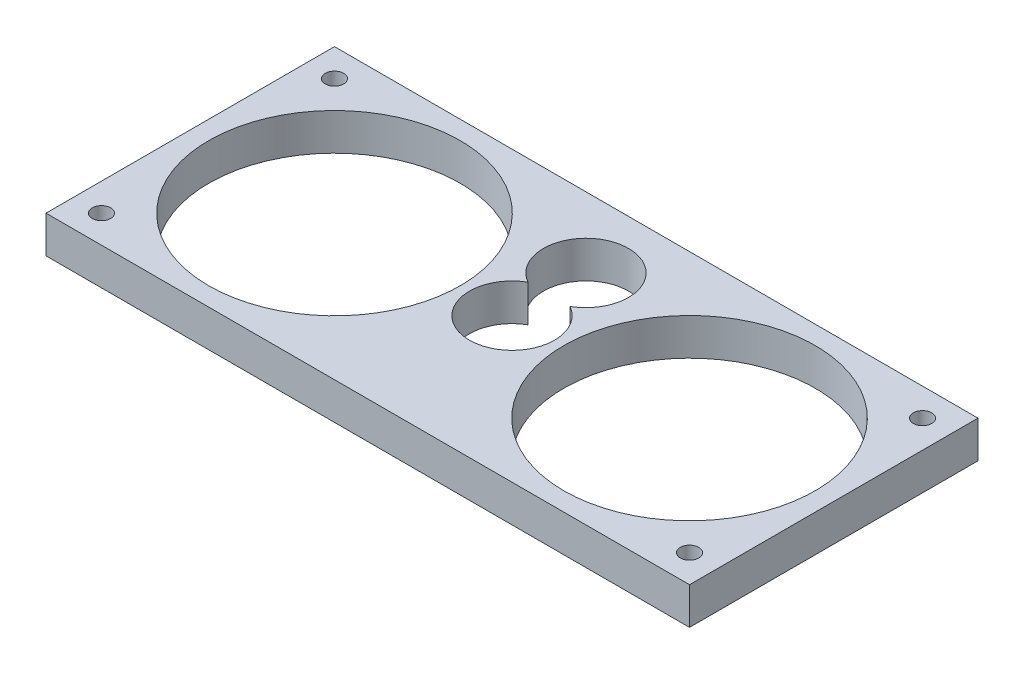
from build123d import *

# Parameters (mm, degrees)
SKETCH1_W           = 174
SKETCH1_H           = 78
SKETCH1_R           = 34
SKETCH1_R_2         = 2.5
BOSS_EXTRUDE1_DEPTH = 10


with BuildPart() as part:
    # Sketch1 → Boss-Extrude1 (new body)
    with BuildSketch(Plane(origin=(0, 0, 0), x_dir=(1, 0, 0), z_dir=(0, 1, 0))):
        Rectangle(SKETCH1_W, SKETCH1_H)
        with Locations(Location((48, 0, 0), (0, 0, 270))):
            Circle(SKETCH1_R, mode=Mode.SUBTRACT)
        with Locations(Location((-48, 0, 0), (0, 0, 270))):
            Circle(SKETCH1_R, mode=Mode.SUBTRACT)
        with Locations(Location((-79.5, 31.5, 0), (0, 0, 270))):
            Circle(SKETCH1_R_2, mode=Mode.SUBTRACT)
        with Locations(Location((-79.5, -31.5, 0), (0, 0, 270))):
            Circle(SKETCH1_R_2, mode=Mode.SUBTRACT)
        with Locations(Location((79.5, -31.5, 0), (0, 0, 270))):
            Circle(SKETCH1_R_2, mode=Mode.SUBTRACT)
        with Locations(Location((79.5, 31.5, 0), (0, 0, 270))):
            Circle(SKETCH1_R_2, mode=Mode.SUBTRACT)
        with BuildLine():
            ThreePointArc((-5.678908346, 10), (0, -11.5), (5.678908346, 10))
            ThreePointArc((5.678908346, 10), (0, 31.5), (-5.678908346, 10))
        make_face(mode=Mode.SUBTRACT)
    extrude(amount=BOSS_EXTRUDE1_DEPTH)


solid = part.part
